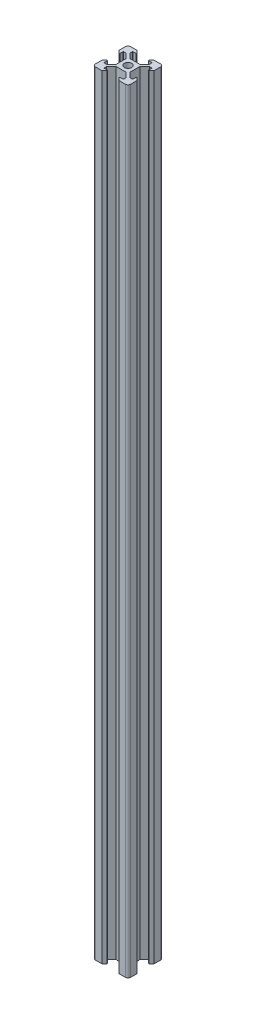
from build123d import *

# Parameters (mm, degrees)
CROQUIS1_R              = 2.1
SALIENTE_EXTRUIR1_DEPTH = 440
REDONDEO1_R             = 1.5
REDONDEO2_R             = 0.2


with BuildPart() as part:
    # Croquis1 → Saliente-Extruir1 (new body)
    with BuildSketch(Plane(origin=(0, 0, 0), x_dir=(1, 0, 0), z_dir=(0, 1, 0))):
        Polygon((-4.9, 10), (-10, 10), (-10, 4.9), (-8.2, 3.1), (-8.2, 5.539339828), (-6.6, 5.539339828), (-3.900660172, 2.84), (-3.900660172, -2.84), (-6.6, -5.539339828), (-8.2, -5.539339828), (-8.2, -3.1), (-10, -4.9), (-10, -10), (-4.9, -10), (-3.1, -8.2), (-5.539339828, -8.2), (-5.539339828, -6.6), (-2.84, -3.900660172), (2.84, -3.900660172), (5.539339828, -6.6), (5.539339828, -8.2), (3.1, -8.2), (4.9, -10), (10, -10), (10, -4.9), (8.2, -3.1), (8.2, -5.539339828), (6.6, -5.539339828), (3.900660172, -2.84), (3.900660172, 2.84), (6.6, 5.539339828), (8.2, 5.539339828), (8.2, 3.1), (10, 4.9), (10, 10), (4.9, 10), (3.1, 8.2), (5.539339828, 8.2), (5.539339828, 6.6), (2.84, 3.900660172), (-2.84, 3.900660172), (-5.539339828, 6.6), (-5.539339828, 8.2), (-3.1, 8.2), align=None)
        Circle(CROQUIS1_R, mode=Mode.SUBTRACT)
    extrude(amount=SALIENTE_EXTRUIR1_DEPTH)

    # Redondeo1
    redondeo1_edges = [part.edges().sort_by_distance(p)[0] for p in [
        (10, 220, 10),
        (-10, 220, 10),
        (-10, 220, -10),
        (10, 220, -10),
    ]]
    fillet(redondeo1_edges, radius=REDONDEO1_R)

    # Redondeo2
    redondeo2_edges = [part.edges().sort_by_distance(p)[0] for p in [
        (-5.539339828, 220, 8.2),
        (5.539339828, 220, 8.2),
        (8.2, 220, 5.539339828),
        (8.2, 220, -5.539339828),
        (5.539339828, 220, -8.2),
        (-5.539339828, 220, -8.2),
        (-8.2, 220, -5.539339828),
        (-8.2, 220, 5.539339828),
        (3.1, 220, 8.2),
        (-3.1, 220, 8.2),
        (8.2, 220, 3.1),
        (8.2, 220, -3.1),
        (3.1, 220, -8.2),
        (-3.1, 220, -8.2),
        (-8.2, 220, -3.1),
        (-8.2, 220, 3.1),
    ]]
    fillet(redondeo2_edges, radius=REDONDEO2_R)


solid = part.part
